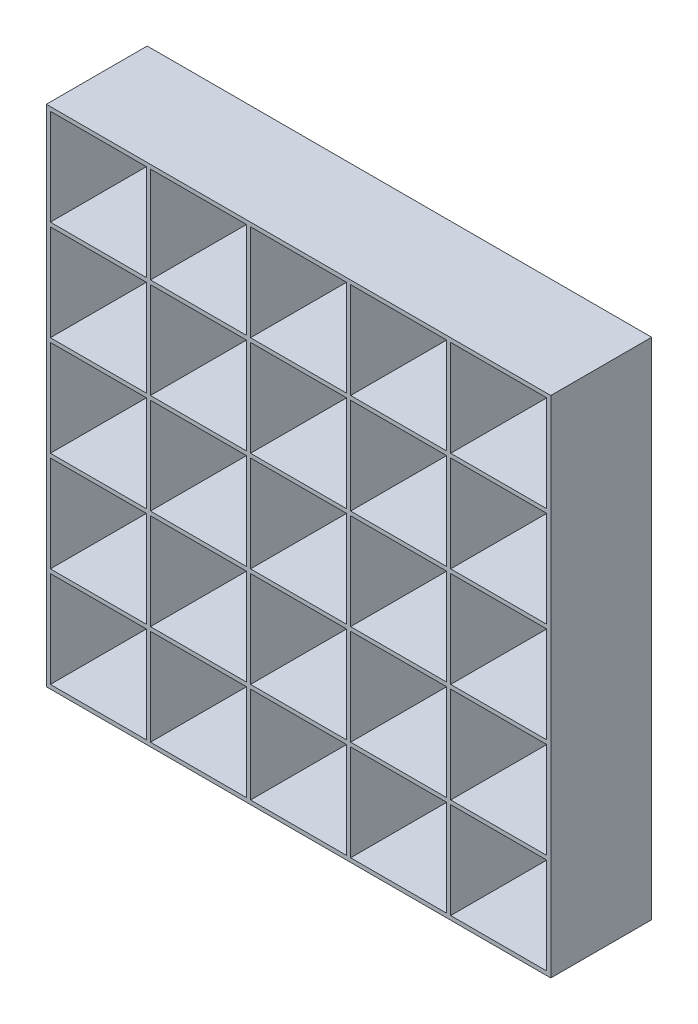
from build123d import *

# Parameters (mm, degrees)
SKETCH1_W           = 2500
SKETCH1_H           = 2500
BOSS_EXTRUDE1_DEPTH = 500
SKETCH3_W           = 476
SKETCH3_H           = 476
CUT_EXTRUDE2_DEPTH  = 1838.117307087


with BuildPart() as part:
    # Sketch1 → Boss-Extrude1 (new body)
    with BuildSketch(Plane.XY):
        Rectangle(SKETCH1_W, SKETCH1_H)
    extrude(amount=BOSS_EXTRUDE1_DEPTH)

    # Sketch3 → Cut-Extrude2 (cut, through all)
    with BuildSketch(Plane.XY.offset(500)):
        Polygon((-754, 1230), (-1230, 1230), (-1230, 754), (-754, 754), (-754, 774.812783864), align=None)
        with Locations((-992, 496)):
            Rectangle(SKETCH3_W, SKETCH3_H)
        with Locations((-992, 0)):
            Rectangle(SKETCH3_W, SKETCH3_H)
        with Locations((-496, 992)):
            Rectangle(SKETCH3_W, SKETCH3_H)
        with Locations((-496, 496)):
            Rectangle(SKETCH3_W, SKETCH3_H)
        with Locations((-496, 0)):
            Rectangle(SKETCH3_W, SKETCH3_H)
        with Locations((-992, -496)):
            Rectangle(SKETCH3_W, SKETCH3_H)
        with Locations((-496, -496)):
            Rectangle(SKETCH3_W, SKETCH3_H)
        Polygon((-258, -754), (-258, -1230), (-734, -1230), (-734, -1170.804779694), (-734, -754), align=None)
        with Locations((-992, -992)):
            Rectangle(SKETCH3_W, SKETCH3_H)
        with Locations((0, -992)):
            Rectangle(SKETCH3_W, SKETCH3_H)
        with Locations((0, -496)):
            Rectangle(SKETCH3_W, SKETCH3_H)
        Rectangle(SKETCH3_W, SKETCH3_H)
        with Locations((0, 496)):
            Rectangle(SKETCH3_W, SKETCH3_H)
        with Locations((0, 992)):
            Rectangle(SKETCH3_W, SKETCH3_H)
        with Locations((496, 992)):
            Rectangle(SKETCH3_W, SKETCH3_H)
        with Locations((496, 496)):
            Rectangle(SKETCH3_W, SKETCH3_H)
        with Locations((496, 0)):
            Rectangle(SKETCH3_W, SKETCH3_H)
        with Locations((496, -496)):
            Rectangle(SKETCH3_W, SKETCH3_H)
        with Locations((496, -992)):
            Rectangle(SKETCH3_W, SKETCH3_H)
        with Locations((992, -992)):
            Rectangle(SKETCH3_W, SKETCH3_H)
        with Locations((992, -496)):
            Rectangle(SKETCH3_W, SKETCH3_H)
        with Locations((992, 0)):
            Rectangle(SKETCH3_W, SKETCH3_H)
        with Locations((992, 496)):
            Rectangle(SKETCH3_W, SKETCH3_H)
        with Locations((992, 992)):
            Rectangle(SKETCH3_W, SKETCH3_H)
    extrude(amount=-CUT_EXTRUDE2_DEPTH, mode=Mode.SUBTRACT)


solid = part.part
